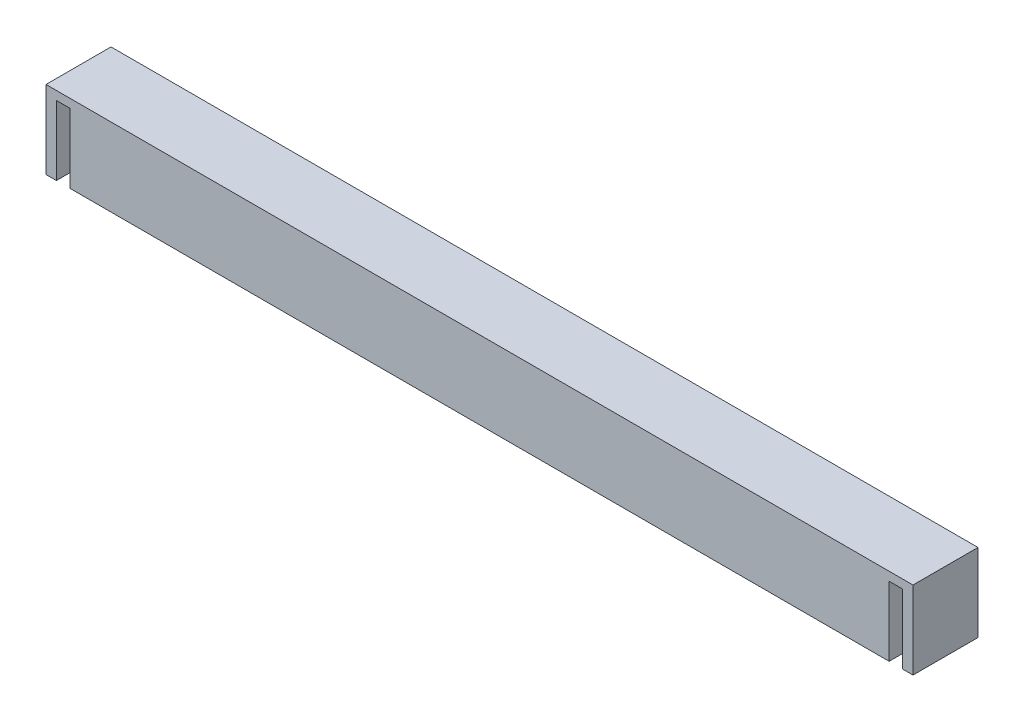
from build123d import *

# Parameters (mm, degrees)
SKETCH1_W               = 200
SKETCH1_H               = 15
FRONT_TOP_BEAM_DEPTH    = 18
SKETCH2_W               = 3.1
SKETCH2_H               = 15
FRONT_TOP_GROOVES_DEPTH = 16
FRONT_TOP_RIB_REACH     = 202.948
SKETCH3_W               = 5
SKETCH3_H               = 18


with BuildPart() as part:
    # Sketch1 → Front Top Beam (new body)
    with BuildSketch(Plane(origin=(0, 0, 0), x_dir=(1, 0, 0), z_dir=(0, 1, 0))):
        Rectangle(SKETCH1_W, SKETCH1_H)
    extrude(amount=FRONT_TOP_BEAM_DEPTH)

    # Sketch2 → Front Top Grooves (cut)
    with BuildSketch(Plane.XZ):
        with Locations((-96.05, 0)):
            Rectangle(SKETCH2_W, SKETCH2_H)
        with Locations((96.05, 0)):
            Rectangle(SKETCH2_W, SKETCH2_H)
    extrude(amount=-FRONT_TOP_GROOVES_DEPTH, mode=Mode.SUBTRACT)

    # Sketch3 → Front Top Rib (add, up to next)
    with BuildSketch(Plane(origin=(100, 0, 0), x_dir=(0, 0, -1), z_dir=(1, 0, 0)), mode=Mode.PRIVATE) as front_top_rib_sk1:
        with Locations((0, 9)):
            Rectangle(SKETCH3_W, SKETCH3_H)
    front_top_rib_tool1 = extrude(front_top_rib_sk1.sketch, amount=-FRONT_TOP_RIB_REACH, mode=Mode.PRIVATE) - part.part
    add(front_top_rib_tool1.solids().sort_by_distance((100, 9, 0))[0])
    add(front_top_rib_tool1.solids().sort_by_distance((100, 9, 0))[1])


solid = part.part
